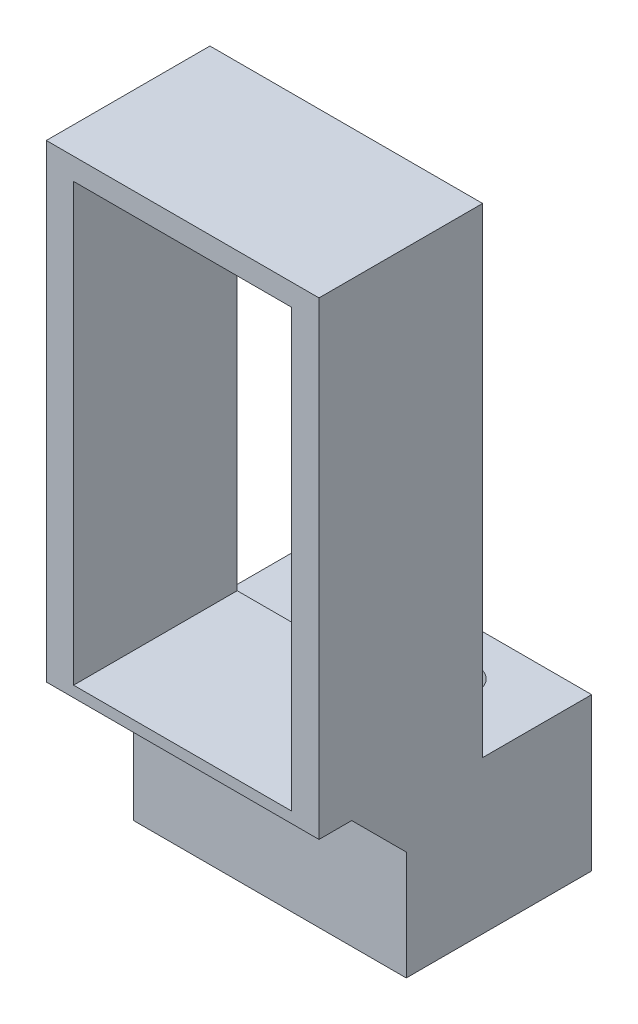
from build123d import *

# Parameters (mm, degrees)
BOSS_EXTRU_1_DEPTH      = 14
ESQUISSE2_W             = 20
ESQUISSE2_H             = 40
BOSS_EXTRU_2_DEPTH      = 15
ENL_V_MAT_EXTRU_1_REACH = 66.384
ENL_V_MAT_EXTRU_2_REACH = 49.418
ESQUISSE4_R             = 2


with BuildPart() as part:
    # Esquisse1 → Boss.-Extru.1 (new body)
    with BuildSketch(Plane(origin=(0, 0, 0), x_dir=(1, 0, 0), z_dir=(0, 1, 0))):
        Polygon((12.5, -12.5), (12.5, 0), (12.5, 12.5), (-12.5, 12.5), (-12.5, -12.5), align=None)
    extrude(amount=BOSS_EXTRU_1_DEPTH)

    # Esquisse2 → Boss.-Extru.2 (add)
    with BuildSketch(Plane.XY.offset(12.5)):
        Polygon((-12.5, 14), (12.5, 14), (12.5, 16.5), (12.5, 58), (-12.5, 58), align=None)
        with Locations((0, 36)):
            Rectangle(ESQUISSE2_W, ESQUISSE2_H, mode=Mode.SUBTRACT)
    extrude(amount=-BOSS_EXTRU_2_DEPTH)

    # Esquisse3 → Enlèv. mat.-Extru.1 (cut, up to next)
    with BuildSketch(Plane.ZY.offset(12.5), mode=Mode.PRIVATE) as enl_v_mat_extru_1_sk1:
        Polygon((12.5, 0), (4.5, 0), (4.5, 10), (9.5, 15), (12.5, 15), align=None)
    enl_v_mat_extru_1_tool1 = extrude(enl_v_mat_extru_1_sk1.sketch, amount=-ENL_V_MAT_EXTRU_1_REACH, mode=Mode.PRIVATE) & part.part
    add(enl_v_mat_extru_1_tool1.solids().sort_by_distance((-12.5, 6.821705, 8.771318))[0], mode=Mode.SUBTRACT)

    # Esquisse4 → Enlèv. mat.-Extru.2 (cut, up to next)
    with BuildSketch(Plane(origin=(0, 14, 0), x_dir=(1, 0, 0), z_dir=(0, 1, 0)), mode=Mode.PRIVATE) as enl_v_mat_extru_2_sk1:
        with Locations(Location((5, 7.5, 0), (0, 0, 270))):
            Circle(ESQUISSE4_R)
    enl_v_mat_extru_2_tool1 = extrude(enl_v_mat_extru_2_sk1.sketch, amount=-ENL_V_MAT_EXTRU_2_REACH, mode=Mode.PRIVATE) & part.part
    # Esquisse4 → Enlèv. mat.-Extru.2 (cut, up to next)
    with BuildSketch(Plane(origin=(0, 14, 0), x_dir=(1, 0, 0), z_dir=(0, 1, 0)), mode=Mode.PRIVATE) as enl_v_mat_extru_2_sk2:
        with Locations(Location((-5, 7.5, 0), (0, 0, 270))):
            Circle(ESQUISSE4_R)
    enl_v_mat_extru_2_tool2 = extrude(enl_v_mat_extru_2_sk2.sketch, amount=-ENL_V_MAT_EXTRU_2_REACH, mode=Mode.PRIVATE) & part.part
    add(enl_v_mat_extru_2_tool1.solids().sort_by_distance((5, 14, -7.5))[0], mode=Mode.SUBTRACT)
    add(enl_v_mat_extru_2_tool2.solids().sort_by_distance((-5, 14, -7.5))[0], mode=Mode.SUBTRACT)


solid = part.part
